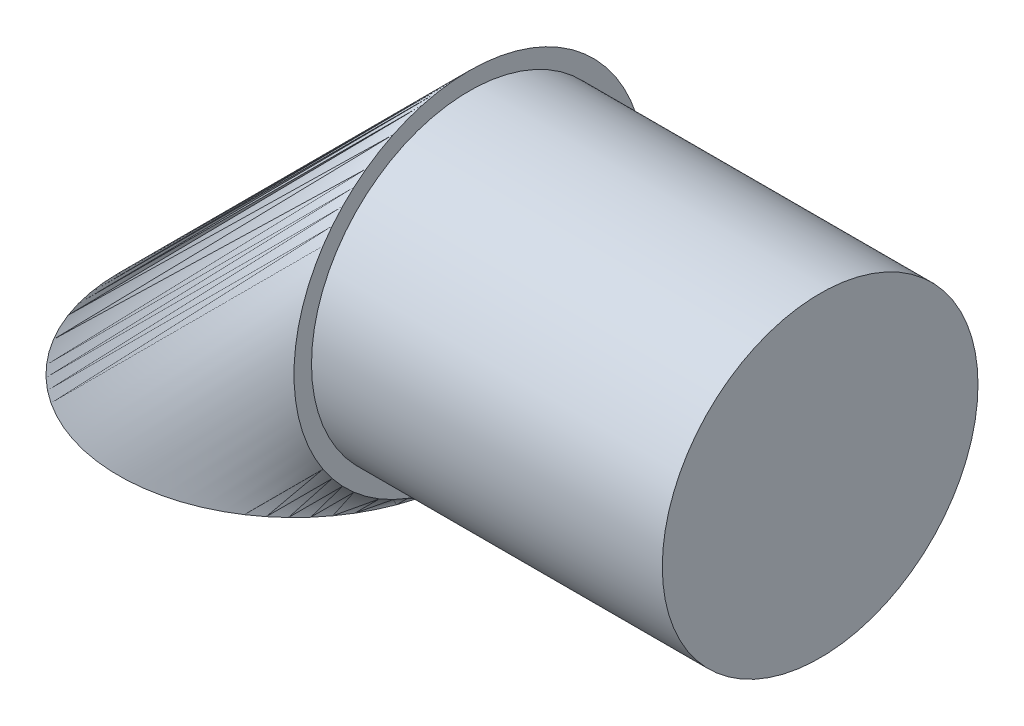
from build123d import *

# Parameters (mm, degrees)
SKETCH2_R           = 50
SKETCH5_R           = 45
BOSS_EXTRUDE1_DEPTH = 100


with BuildPart() as part:
    # Sweep1: sweep along a path in Sketch4
    with BuildLine(Plane.XY) as sweep1_path:
        ThreePointArc((0, 0), (14.644660941, 35.355339059), (50, 50))
    # Sketch2 → Sweep1 (sweep)
    with BuildSketch(Plane(origin=(0, 0, 0), x_dir=(1, 0, 0), z_dir=(0, 1, 0))):
        Circle(SKETCH2_R)
    sweep(path=sweep1_path.line)

    # Sketch5 → Boss-Extrude1 (add)
    with BuildSketch(Plane(origin=(50, 0, 0), x_dir=(0, 0, -1), z_dir=(1, 0, 0))):
        with Locations((0, 50)):
            Circle(SKETCH5_R)
    extrude(amount=BOSS_EXTRUDE1_DEPTH)


solid = part.part
